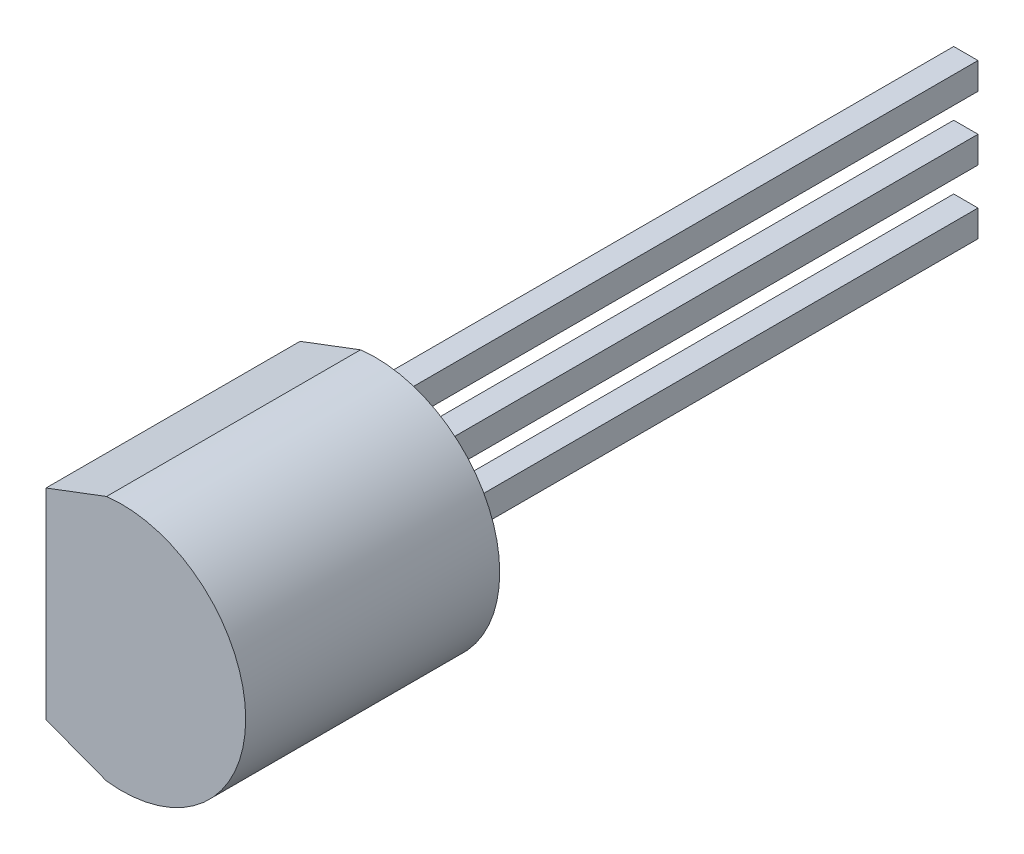
from build123d import *

# Parameters (mm, degrees)
BOSS_EXTRU_1_DEPTH = 5.33
ESQUISSE2_W        = 0.51
ESQUISSE2_H        = 0.56
BOSS_EXTRU_2_DEPTH = 12.7


with BuildPart() as part:
    # Esquisse1 → Boss.-Extru.1 (new body)
    with BuildSketch(Plane.XY):
        with BuildLine():
            Line((-1.27, 2.105), (-1.27, -2.105))
            Line((-1.27, -2.105), (0, -2.585884762))
            ThreePointArc((0, -2.585884762), (2.92, 0), (0, 2.585884762))
            Line((0, 2.585884762), (-1.27, 2.105))
        make_face()
    extrude(amount=BOSS_EXTRU_1_DEPTH)

    # Esquisse2 → Boss.-Extru.2 (add)
    with BuildSketch(Plane(origin=(0, 0, 0), x_dir=(-1, 0, 0), z_dir=(0, 0, -1))):
        with Locations((0, 1.34)):
            Rectangle(ESQUISSE2_W, ESQUISSE2_H)
        Rectangle(ESQUISSE2_W, ESQUISSE2_H)
        with Locations((0, -1.34)):
            Rectangle(ESQUISSE2_W, ESQUISSE2_H)
    extrude(amount=BOSS_EXTRU_2_DEPTH)


solid = part.part
